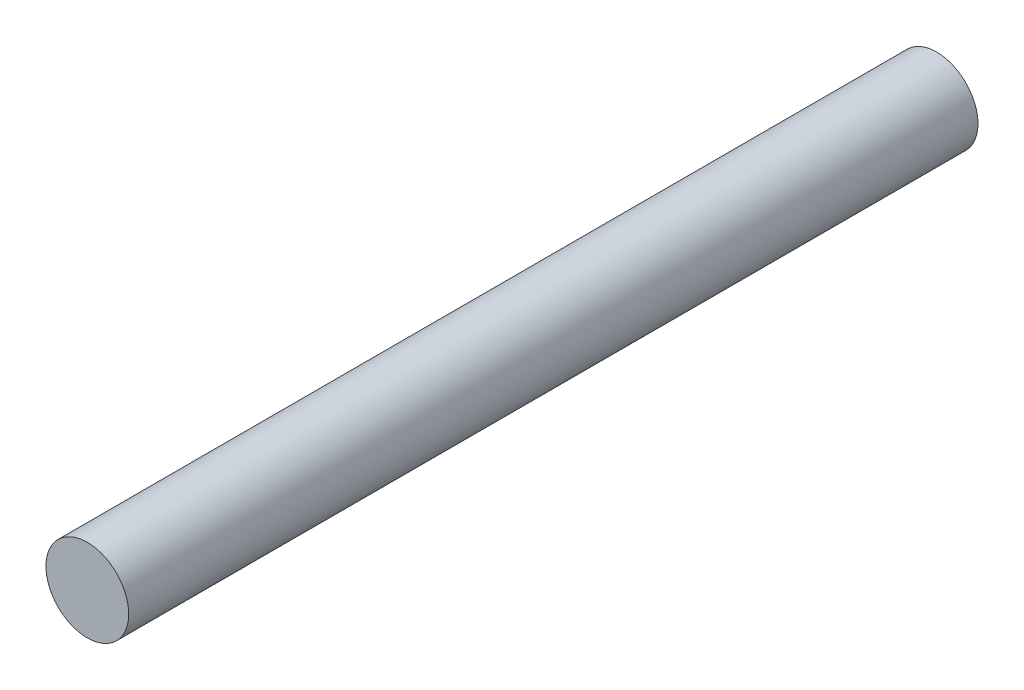
from build123d import *

# Parameters (mm, degrees)
SKETCH1_R           = 0.7366
BOSS_EXTRUDE1_DEPTH = 15.113


with BuildPart() as part:
    # Sketch1 → Boss-Extrude1 (new body)
    with BuildSketch(Plane.XY):
        Circle(SKETCH1_R)
    extrude(amount=BOSS_EXTRUDE1_DEPTH)


solid = part.part
